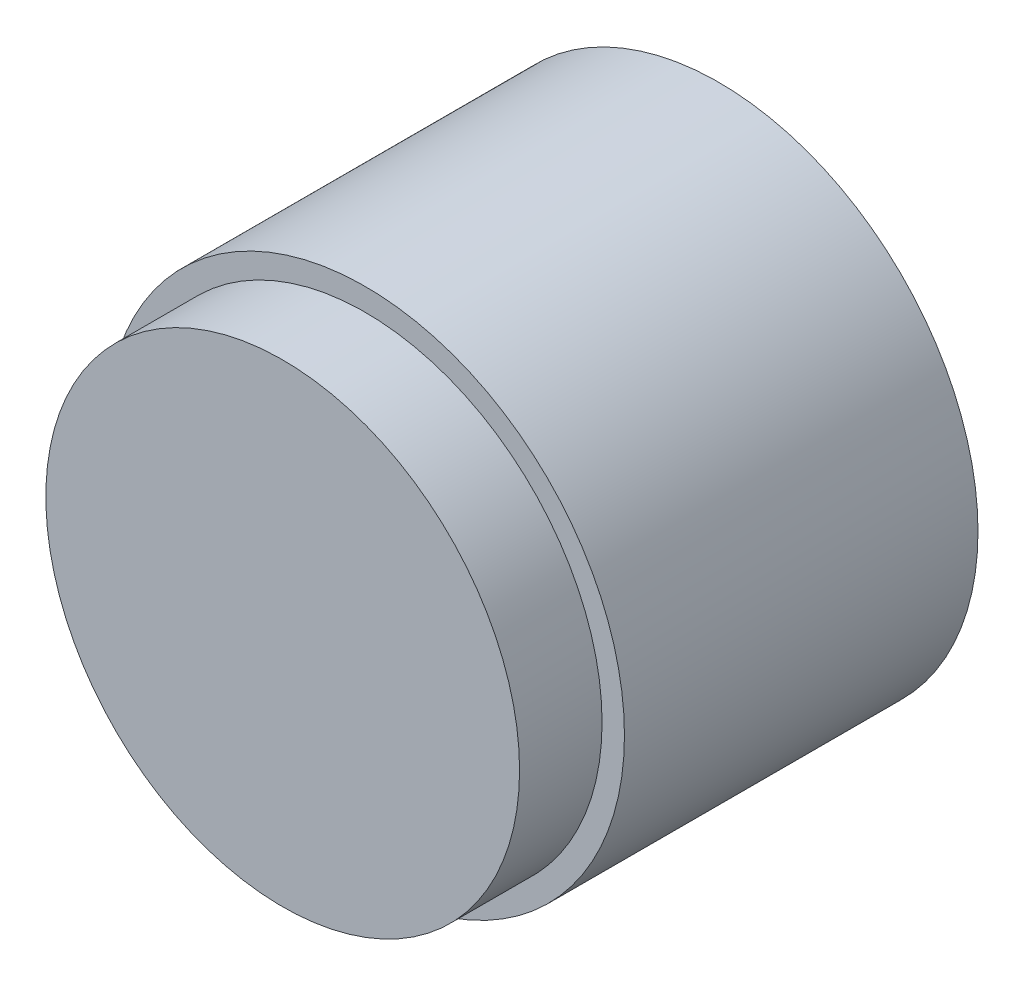
from build123d import *

# Parameters (mm, degrees)
SKETCH1_R           = 11
BOSS_EXTRUDE1_DEPTH = 15
SKETCH2_R           = 10.05
BOSS_EXTRUDE2_DEPTH = 3.5


with BuildPart() as part:
    # Sketch1 → Boss-Extrude1 (new body)
    with BuildSketch(Plane(origin=(0, 0, 0), x_dir=(0, 1, 0), z_dir=(0, 0, 1))):
        with Locations(Location((0, 0, 0), (0, 0, 270))):
            Circle(SKETCH1_R)
    extrude(amount=BOSS_EXTRUDE1_DEPTH)

    # Sketch2 → Boss-Extrude2 (add)
    with BuildSketch(Plane.XY.offset(15)):
        Circle(SKETCH2_R)
    extrude(amount=BOSS_EXTRUDE2_DEPTH)


solid = part.part
